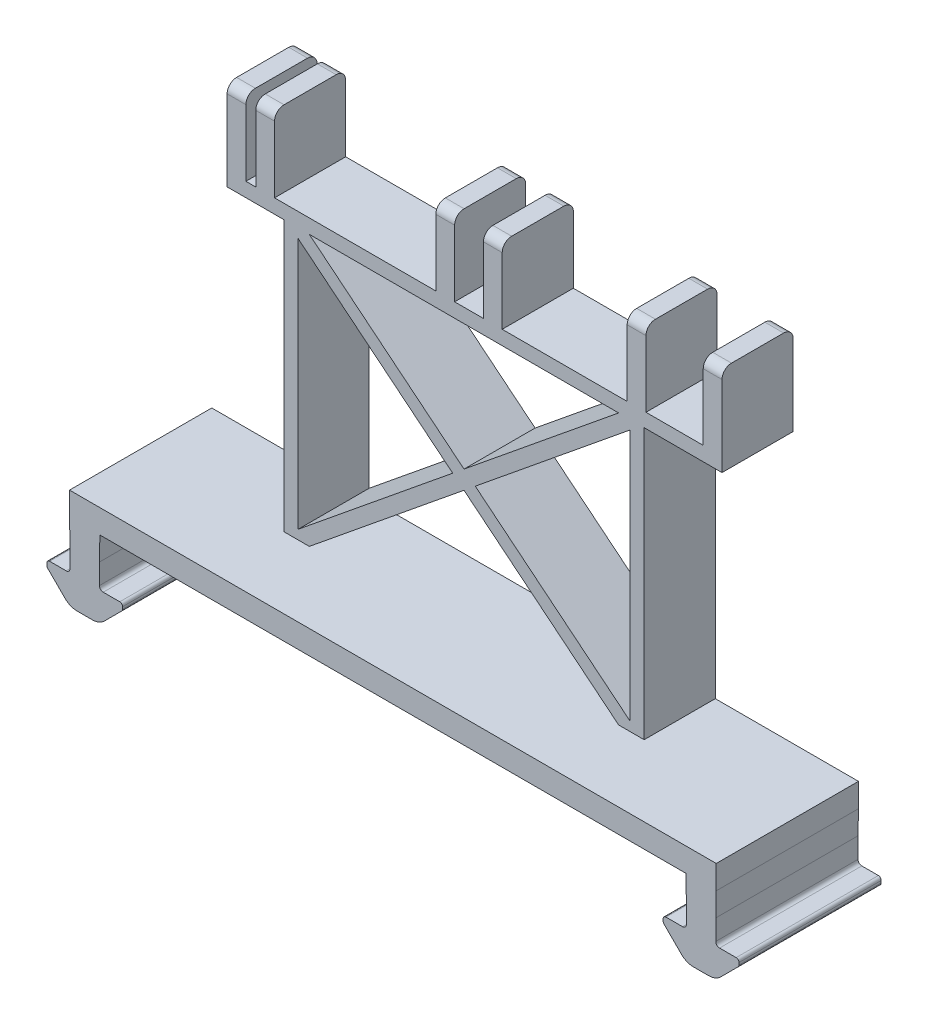
from build123d import *

# Parameters (mm, degrees)
BOSS_EXTRUDE2_DEPTH  = 38.1
BOSS_EXTRUDE6_DEPTH  = 19.05
SKETCH6_W            = 5.08
SKETCH6_H            = 19.05
BOSS_EXTRUDE5_DEPTH  = 20.32
SKETCH10_W           = 23.1648
SKETCH10_H           = 3.81
SKETCH10_W_2         = 17.5006
CUT_EXTRUDE3_DEPTH   = 19.05
FILLET1_R            = 2.54
BOSS_EXTRUDE7_DEPTH  = 19.05
CLEARANCE_START      = -38.1
SKETCH3_W            = 2.6416
SKETCH3_H            = 20.32
SKETCH3_W_2          = 7.7216
SKETCH3_W_3          = 15.3416
CLEARANCE_TRIM_DEPTH = 38.1


with BuildPart() as part:
    # Sketch1 → Boss-Extrude2 (new body)
    with BuildSketch(Plane.XY):
        with BuildLine():
            Line((-2.016886463, 6.858), (2.016886463, 6.858))
            ThreePointArc((2.016886463, 6.858), (3.83455623, 7.219556996), (5.375502252, 8.249184211))
            Line((5.375502252, 8.249184211), (10.026617928, 12.900299887))
            ThreePointArc((10.026617928, 12.900299887), (10.219328904, 13.188712244), (10.287, 13.528917816))
            Line((10.287, 13.528917816), (10.287, 14.097877816))
            ThreePointArc((10.287, 14.097877816), (10.026617928, 14.726495744), (9.398, 14.986877816))
            Line((9.398, 14.986877816), (4.953, 14.986877816))
            ThreePointArc((4.953, 14.986877816), (4.324382072, 15.247259887), (4.064, 15.875877816))
            Line((4.064, 15.875877816), (4.064, 27.686877816))
            Line((4.064, 27.686877816), (161.036, 27.686877816))
            Line((161.036, 27.686877816), (161.036, 15.875877816))
            ThreePointArc((161.036, 15.875877816), (160.775617928, 15.247259887), (160.147, 14.986877816))
            Line((160.147, 14.986877816), (155.702, 14.986877816))
            ThreePointArc((155.702, 14.986877816), (155.073382072, 14.726495744), (154.813, 14.097877816))
            Line((154.813, 14.097877816), (154.813, 13.528917816))
            ThreePointArc((154.813, 13.528917816), (154.880671096, 13.188712244), (155.073382072, 12.900299887))
            Line((155.073382072, 12.900299887), (159.724497748, 8.249184211))
            ThreePointArc((159.724497748, 8.249184211), (161.26544377, 7.219556996), (163.083113537, 6.858))
            Line((163.083113537, 6.858), (167.116886463, 6.858))
            ThreePointArc((167.116886463, 6.858), (168.93455623, 7.219556996), (170.475502252, 8.249184211))
            Line((170.475502252, 8.249184211), (175.126617928, 12.900299887))
            ThreePointArc((175.126617928, 12.900299887), (175.319328904, 13.188712244), (175.387, 13.528917816))
            Line((175.387, 13.528917816), (175.387, 14.097877816))
            ThreePointArc((175.387, 14.097877816), (175.126617928, 14.726495744), (174.498, 14.986877816))
            Line((174.498, 14.986877816), (170.053, 14.986877816))
            ThreePointArc((170.053, 14.986877816), (169.424382072, 15.247259887), (169.164, 15.875877816))
            Line((169.164, 15.875877816), (169.164, 27.686877816))
            Line((169.164, 27.686877816), (169.164, 34.036877816))
            Line((169.164, 34.036877816), (-4.064, 34.036877816))
            Line((-4.064, 34.036877816), (-4.064, 27.686877816))
            Line((-4.064, 27.686877816), (-4.064, 15.875877816))
            ThreePointArc((-4.064, 15.875877816), (-4.324382072, 15.247259887), (-4.953, 14.986877816))
            Line((-4.953, 14.986877816), (-9.398, 14.986877816))
            ThreePointArc((-9.398, 14.986877816), (-10.026617928, 14.726495744), (-10.287, 14.097877816))
            Line((-10.287, 14.097877816), (-10.287, 13.528917816))
            ThreePointArc((-10.287, 13.528917816), (-10.219328904, 13.188712244), (-10.026617928, 12.900299887))
            Line((-10.026617928, 12.900299887), (-5.375502252, 8.249184211))
            ThreePointArc((-5.375502252, 8.249184211), (-3.83455623, 7.219556996), (-2.016886463, 6.858))
        make_face()
    extrude(amount=BOSS_EXTRUDE2_DEPTH)

    # Sketch7 → Boss-Extrude6 (add)
    with BuildSketch(Plane.XY):
        Polygon((130.81, 106.426877816), (169.164, 106.426877816), (169.164, 110.236877816), (-4.064, 110.236877816), (-4.064, 106.426877816), (34.29, 106.426877816), (34.29, 34.036877816), (38.1, 34.036877816), (38.1, 106.426877816), (127, 106.426877816), (127, 34.036877816), (130.81, 34.036877816), align=None)
    extrude(amount=BOSS_EXTRUDE6_DEPTH)

    # Sketch6 → Boss-Extrude5 (add)
    with BuildSketch(Plane(origin=(0, 110.236877816, 0), x_dir=(1, 0, 0), z_dir=(0, 1, 0))):
        with Locations((21.6408, -9.525)):
            Rectangle(SKETCH6_W, SKETCH6_H)
        with Locations((29.2608, -9.525)):
            Rectangle(SKETCH6_W, SKETCH6_H)
        with Locations((77.5462, -9.525)):
            Rectangle(SKETCH6_W, SKETCH6_H)
        with Locations((90.2462, -9.525)):
            Rectangle(SKETCH6_W, SKETCH6_H)
        with Locations((128.8034, -9.525)):
            Rectangle(SKETCH6_W, SKETCH6_H)
        with Locations((149.1234, -9.525)):
            Rectangle(SKETCH6_W, SKETCH6_H)
    extrude(amount=BOSS_EXTRUDE5_DEPTH)

    # Sketch10 → Cut-Extrude3 (cut)
    with BuildSketch(Plane.XY):
        with Locations((7.5184, 108.331877816)):
            Rectangle(SKETCH10_W, SKETCH10_H)
        with Locations((160.4137, 108.331877816)):
            Rectangle(SKETCH10_W_2, SKETCH10_H)
    extrude(amount=CUT_EXTRUDE3_DEPTH, mode=Mode.SUBTRACT)

    # Fillet1
    fillet1_edges = [part.edges().sort_by_distance(p)[0] for p in [
        (21.6408, 130.556877816, 19.05),
        (21.6408, 130.556877816, 0),
        (29.2608, 130.556877816, 0),
        (29.2608, 130.556877816, 19.05),
        (77.5462, 130.556877816, 0),
        (77.5462, 130.556877816, 19.05),
        (90.2462, 130.556877816, 0),
        (90.2462, 130.556877816, 19.05),
        (128.8034, 130.556877816, 0),
        (128.8034, 130.556877816, 19.05),
        (149.1234, 130.556877816, 0),
        (149.1234, 130.556877816, 19.05),
    ]]
    fillet(fillet1_edges, radius=FILLET1_R)

    # Sketch11 → Boss-Extrude7 (add)
    with BuildSketch(Plane.XY):
        Polygon((38.1, 103.970194938), (79.533021028, 70.231877816), (38.1, 36.493560693), (38.1, 34.036877816), (41.116978972, 34.036877816), (82.55, 67.775194938), (123.983021028, 34.036877816), (127, 34.036877816), (127, 36.493560693), (85.566978972, 70.231877816), (127, 103.970194938), (127, 106.426877816), (123.983021028, 106.426877816), (82.55, 72.688560693), (41.116978972, 106.426877816), (38.1, 106.426877816), align=None)
    extrude(amount=BOSS_EXTRUDE7_DEPTH)

    # Sketch3 → Clearance Trim (cut)
    with BuildSketch(Plane.XY.offset(38.1).offset(CLEARANCE_START)):
        with BuildLine():
            Line((4.064, 27.686877816), (3.937, 21.336877816))
            Line((3.937, 21.336877816), (3.937, 15.875877816))
            ThreePointArc((3.937, 15.875877816), (4.23457951, 15.157457326), (4.953, 14.859877816))
            Line((4.953, 14.859877816), (9.398, 14.859877816))
            ThreePointArc((9.398, 14.859877816), (9.936815367, 14.636693183), (10.16, 14.097877816))
            Line((10.16, 14.097877816), (10.16, 13.528917816))
            ThreePointArc((10.16, 13.528917816), (10.101996204, 13.23731304), (9.936815367, 12.990102448))
            Line((9.936815367, 12.990102448), (5.285699691, 8.338986772))
            ThreePointArc((5.285699691, 8.338986772), (3.785955434, 7.336889697), (2.016886463, 6.985))
            Line((2.016886463, 6.985), (-2.016886463, 6.985))
            ThreePointArc((-2.016886463, 6.985), (-3.785955434, 7.336889697), (-5.285699691, 8.338986772))
            Line((-5.285699691, 8.338986772), (-9.936815367, 12.990102448))
            ThreePointArc((-9.936815367, 12.990102448), (-10.101996204, 13.23731304), (-10.16, 13.528917816))
            Line((-10.16, 13.528917816), (-10.16, 14.097877816))
            ThreePointArc((-10.16, 14.097877816), (-9.936815367, 14.636693183), (-9.398, 14.859877816))
            Line((-9.398, 14.859877816), (-4.953, 14.859877816))
            ThreePointArc((-4.953, 14.859877816), (-4.23457951, 15.157457326), (-3.937, 15.875877816))
            Line((-3.937, 15.875877816), (-3.937, 21.336877816))
            Line((-3.937, 21.336877816), (-4.064, 27.686877816))
            Line((-4.064, 27.686877816), (-4.064, 15.875877816))
            ThreePointArc((-4.064, 15.875877816), (-4.324382072, 15.247259887), (-4.953, 14.986877816))
            Line((-4.953, 14.986877816), (-9.398, 14.986877816))
            ThreePointArc((-9.398, 14.986877816), (-10.026617928, 14.726495744), (-10.287, 14.097877816))
            Line((-10.287, 14.097877816), (-10.287, 13.528917816))
            ThreePointArc((-10.287, 13.528917816), (-10.219328904, 13.188712244), (-10.026617928, 12.900299887))
            Line((-10.026617928, 12.900299887), (-5.375502252, 8.249184211))
            ThreePointArc((-5.375502252, 8.249184211), (-3.83455623, 7.219556996), (-2.016886463, 6.858))
            Line((-2.016886463, 6.858), (2.016886463, 6.858))
            ThreePointArc((2.016886463, 6.858), (3.83455623, 7.219556996), (5.375502252, 8.249184211))
            Line((5.375502252, 8.249184211), (10.026617928, 12.900299887))
            ThreePointArc((10.026617928, 12.900299887), (10.219328904, 13.188712244), (10.287, 13.528917816))
            Line((10.287, 13.528917816), (10.287, 14.097877816))
            ThreePointArc((10.287, 14.097877816), (10.026617928, 14.726495744), (9.398, 14.986877816))
            Line((9.398, 14.986877816), (4.953, 14.986877816))
            ThreePointArc((4.953, 14.986877816), (4.324382072, 15.247259887), (4.064, 15.875877816))
            Line((4.064, 15.875877816), (4.064, 27.686877816))
        make_face()
        with BuildLine():
            Line((161.036, 27.686877816), (161.163, 21.336877816))
            Line((161.163, 21.336877816), (161.163, 15.875877816))
            ThreePointArc((161.163, 15.875877816), (160.86542049, 15.157457326), (160.147, 14.859877816))
            Line((160.147, 14.859877816), (155.702, 14.859877816))
            ThreePointArc((155.702, 14.859877816), (155.163184633, 14.636693183), (154.94, 14.097877816))
            Line((154.94, 14.097877816), (154.94, 13.528917816))
            ThreePointArc((154.94, 13.528917816), (154.998003796, 13.23731304), (155.163184633, 12.990102448))
            Line((155.163184633, 12.990102448), (159.814300309, 8.338986772))
            ThreePointArc((159.814300309, 8.338986772), (161.314044566, 7.336889697), (163.083113537, 6.985))
            Line((163.083113537, 6.985), (167.116886463, 6.985))
            ThreePointArc((167.116886463, 6.985), (168.885955434, 7.336889697), (170.385699691, 8.338986772))
            Line((170.385699691, 8.338986772), (175.036815367, 12.990102448))
            ThreePointArc((175.036815367, 12.990102448), (175.201996204, 13.23731304), (175.26, 13.528917816))
            Line((175.26, 13.528917816), (175.26, 14.097877816))
            ThreePointArc((175.26, 14.097877816), (175.036815367, 14.636693183), (174.498, 14.859877816))
            Line((174.498, 14.859877816), (170.053, 14.859877816))
            ThreePointArc((170.053, 14.859877816), (169.33457951, 15.157457326), (169.037, 15.875877816))
            Line((169.037, 15.875877816), (169.037, 21.336877816))
            Line((169.037, 21.336877816), (169.164, 27.686877816))
            Line((169.164, 27.686877816), (169.164, 15.875877816))
            ThreePointArc((169.164, 15.875877816), (169.424382072, 15.247259887), (170.053, 14.986877816))
            Line((170.053, 14.986877816), (174.498, 14.986877816))
            ThreePointArc((174.498, 14.986877816), (175.126617928, 14.726495744), (175.387, 14.097877816))
            Line((175.387, 14.097877816), (175.387, 13.528917816))
            ThreePointArc((175.387, 13.528917816), (175.319328904, 13.188712244), (175.126617928, 12.900299887))
            Line((175.126617928, 12.900299887), (170.475502252, 8.249184211))
            ThreePointArc((170.475502252, 8.249184211), (168.93455623, 7.219556996), (167.116886463, 6.858))
            Line((167.116886463, 6.858), (163.083113537, 6.858))
            ThreePointArc((163.083113537, 6.858), (161.26544377, 7.219556996), (159.724497748, 8.249184211))
            Line((159.724497748, 8.249184211), (155.073382072, 12.900299887))
            ThreePointArc((155.073382072, 12.900299887), (154.880671096, 13.188712244), (154.813, 13.528917816))
            Line((154.813, 13.528917816), (154.813, 14.097877816))
            ThreePointArc((154.813, 14.097877816), (155.073382072, 14.726495744), (155.702, 14.986877816))
            Line((155.702, 14.986877816), (160.147, 14.986877816))
            ThreePointArc((160.147, 14.986877816), (160.775617928, 15.247259887), (161.036, 15.875877816))
            Line((161.036, 15.875877816), (161.036, 27.686877816))
        make_face()
        with Locations((25.4508, 120.396877816)):
            Rectangle(SKETCH3_W, SKETCH3_H)
        with Locations((83.8962, 120.396877816)):
            Rectangle(SKETCH3_W_2, SKETCH3_H)
        with Locations((138.9634, 120.396877816)):
            Rectangle(SKETCH3_W_3, SKETCH3_H)
    extrude(amount=CLEARANCE_TRIM_DEPTH, mode=Mode.SUBTRACT)


solid = part.part
